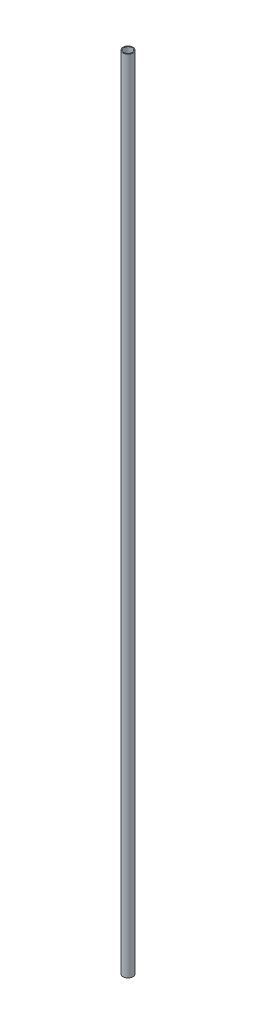
from build123d import *

# Parameters (mm, degrees)
SKETCH1_R           = 3
SKETCH1_R_2         = 2.5
BOSS_EXTRUDE1_DEPTH = 480


with BuildPart() as part:
    # Sketch1 → Boss-Extrude1 (new body)
    with BuildSketch(Plane(origin=(0, 0, 0), x_dir=(1, 0, 0), z_dir=(0, 1, 0))):
        with Locations(Location((0, 0, 0), (0, 0, 270))):
            Circle(SKETCH1_R)
        with Locations(Location((0, 0, 0), (0, 0, 270))):
            Circle(SKETCH1_R_2, mode=Mode.SUBTRACT)
    extrude(amount=BOSS_EXTRUDE1_DEPTH)


solid = part.part
